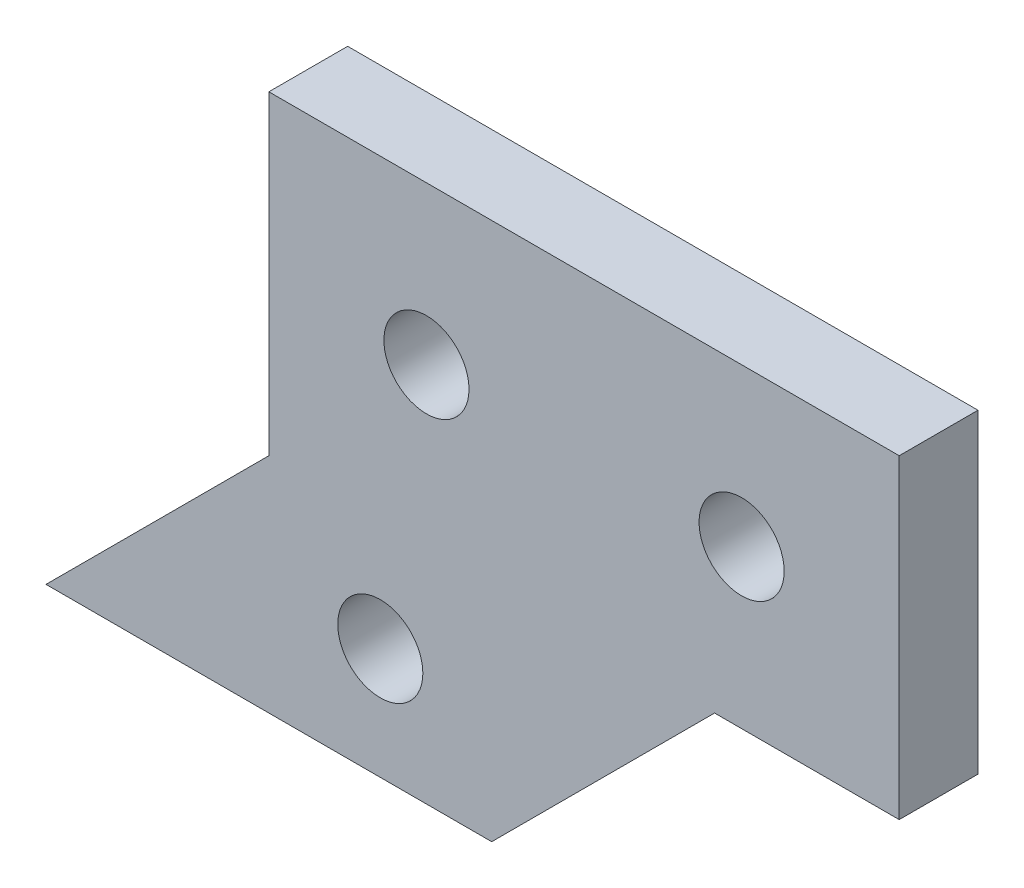
from build123d import *

# Parameters (mm, degrees)
SKETCH1_R           = 3.429
BOSS_EXTRUDE1_DEPTH = 6.35


with BuildPart() as part:
    # Sketch1 → Boss-Extrude1 (new body)
    with BuildSketch(Plane.XY):
        Polygon((35.921024484, -25.4), (17.960512242, -43.360512242), (-17.960512242, -43.360512242), (0, -25.4), (0, 0), (50.8, 0), (50.8, -25.4), align=None)
        with Locations((12.7, -12.7)):
            Circle(SKETCH1_R, mode=Mode.SUBTRACT)
        with Locations((38.1, -12.7)):
            Circle(SKETCH1_R, mode=Mode.SUBTRACT)
        with Locations((8.980256121, -34.380256121)):
            Circle(SKETCH1_R, mode=Mode.SUBTRACT)
    extrude(amount=BOSS_EXTRUDE1_DEPTH)


solid = part.part
